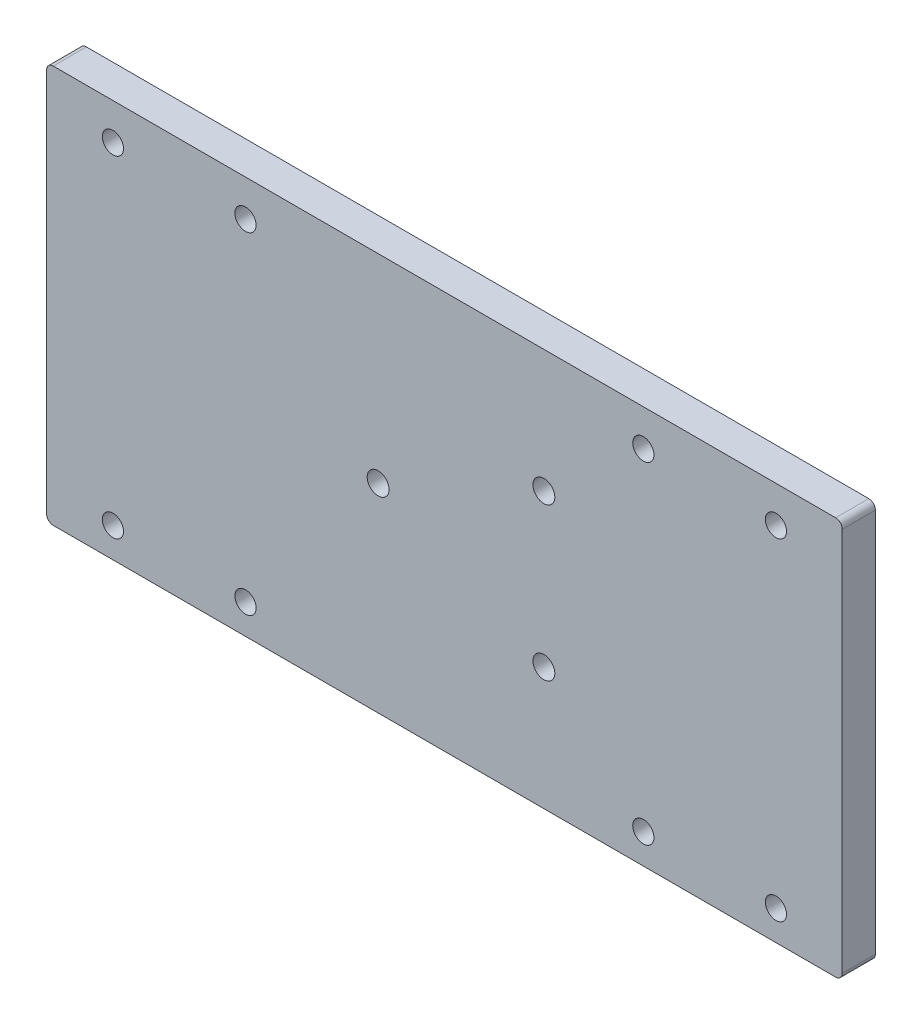
from build123d import *

# Parameters (mm, degrees)
SKETCH_1_W          = 120
SKETCH_1_H          = 60
EXTRUDE_1_DEPTH     = 5
CUT_EXTRUDE_1_REACH = 115.997
SKETCH_2_R          = 1.65
CUT_EXTRUDE_2_REACH = 115.997
SKETCH_4_R          = 1.6
FILLET_1_R          = 1


with BuildPart() as part:
    # 草图1 → 凸台-拉伸1 (new body)
    with BuildSketch(Plane.XY):
        with Locations((-40, -24.5)):
            Rectangle(SKETCH_1_W, SKETCH_1_H)
    extrude(amount=EXTRUDE_1_DEPTH)

    # 草图2 → 切除-拉伸1 (cut, up to next)
    with BuildSketch(Plane.XY.offset(5), mode=Mode.PRIVATE) as cut_extrude_1_sk1:
        with Locations((-25, -13)):
            Circle(SKETCH_2_R)
    cut_extrude_1_tool1 = extrude(cut_extrude_1_sk1.sketch, amount=-CUT_EXTRUDE_1_REACH, mode=Mode.PRIVATE) & part.part
    # 草图2 → 切除-拉伸1 (cut, up to next)
    with BuildSketch(Plane.XY.offset(5), mode=Mode.PRIVATE) as cut_extrude_1_sk2:
        with Locations((-50, -24.5)):
            Circle(SKETCH_2_R)
    cut_extrude_1_tool2 = extrude(cut_extrude_1_sk2.sketch, amount=-CUT_EXTRUDE_1_REACH, mode=Mode.PRIVATE) & part.part
    # 草图2 → 切除-拉伸1 (cut, up to next)
    with BuildSketch(Plane.XY.offset(5), mode=Mode.PRIVATE) as cut_extrude_1_sk3:
        with Locations((-25, -36)):
            Circle(SKETCH_2_R)
    cut_extrude_1_tool3 = extrude(cut_extrude_1_sk3.sketch, amount=-CUT_EXTRUDE_1_REACH, mode=Mode.PRIVATE) & part.part
    add(cut_extrude_1_tool1.solids().sort_by_distance((-25, -13, 5))[0], mode=Mode.SUBTRACT)
    add(cut_extrude_1_tool2.solids().sort_by_distance((-50, -24.5, 5))[0], mode=Mode.SUBTRACT)
    add(cut_extrude_1_tool3.solids().sort_by_distance((-25, -36, 5))[0], mode=Mode.SUBTRACT)

    # 草图4 → 切除-拉伸2 (cut, up to next)
    with BuildSketch(Plane(origin=(0, 0, 0), x_dir=(-1, 0, 0), z_dir=(0, 0, -1)), mode=Mode.PRIVATE) as cut_extrude_2_sk1:
        with Locations((90, 0)):
            Circle(SKETCH_4_R)
    cut_extrude_2_tool1 = extrude(cut_extrude_2_sk1.sketch, amount=-CUT_EXTRUDE_2_REACH, mode=Mode.PRIVATE) & part.part
    # 草图4 → 切除-拉伸2 (cut, up to next)
    with BuildSketch(Plane(origin=(0, 0, 0), x_dir=(-1, 0, 0), z_dir=(0, 0, -1)), mode=Mode.PRIVATE) as cut_extrude_2_sk2:
        with Locations((70, 0)):
            Circle(SKETCH_4_R)
    cut_extrude_2_tool2 = extrude(cut_extrude_2_sk2.sketch, amount=-CUT_EXTRUDE_2_REACH, mode=Mode.PRIVATE) & part.part
    # 草图4 → 切除-拉伸2 (cut, up to next)
    with BuildSketch(Plane(origin=(0, 0, 0), x_dir=(-1, 0, 0), z_dir=(0, 0, -1)), mode=Mode.PRIVATE) as cut_extrude_2_sk3:
        with Locations((70, -50)):
            Circle(SKETCH_4_R)
    cut_extrude_2_tool3 = extrude(cut_extrude_2_sk3.sketch, amount=-CUT_EXTRUDE_2_REACH, mode=Mode.PRIVATE) & part.part
    # 草图4 → 切除-拉伸2 (cut, up to next)
    with BuildSketch(Plane(origin=(0, 0, 0), x_dir=(-1, 0, 0), z_dir=(0, 0, -1)), mode=Mode.PRIVATE) as cut_extrude_2_sk4:
        with Locations((90, -50)):
            Circle(SKETCH_4_R)
    cut_extrude_2_tool4 = extrude(cut_extrude_2_sk4.sketch, amount=-CUT_EXTRUDE_2_REACH, mode=Mode.PRIVATE) & part.part
    # 草图4 → 切除-拉伸2 (cut, up to next)
    with BuildSketch(Plane(origin=(0, 0, 0), x_dir=(-1, 0, 0), z_dir=(0, 0, -1)), mode=Mode.PRIVATE) as cut_extrude_2_sk5:
        with Locations((10, -50)):
            Circle(SKETCH_4_R)
    cut_extrude_2_tool5 = extrude(cut_extrude_2_sk5.sketch, amount=-CUT_EXTRUDE_2_REACH, mode=Mode.PRIVATE) & part.part
    # 草图4 → 切除-拉伸2 (cut, up to next)
    with BuildSketch(Plane(origin=(0, 0, 0), x_dir=(-1, 0, 0), z_dir=(0, 0, -1)), mode=Mode.PRIVATE) as cut_extrude_2_sk6:
        with Locations((-10, -50)):
            Circle(SKETCH_4_R)
    cut_extrude_2_tool6 = extrude(cut_extrude_2_sk6.sketch, amount=-CUT_EXTRUDE_2_REACH, mode=Mode.PRIVATE) & part.part
    # 草图4 → 切除-拉伸2 (cut, up to next)
    with BuildSketch(Plane(origin=(0, 0, 0), x_dir=(-1, 0, 0), z_dir=(0, 0, -1)), mode=Mode.PRIVATE) as cut_extrude_2_sk7:
        with Locations((-10, 0)):
            Circle(SKETCH_4_R)
    cut_extrude_2_tool7 = extrude(cut_extrude_2_sk7.sketch, amount=-CUT_EXTRUDE_2_REACH, mode=Mode.PRIVATE) & part.part
    # 草图4 → 切除-拉伸2 (cut, up to next)
    with BuildSketch(Plane(origin=(0, 0, 0), x_dir=(-1, 0, 0), z_dir=(0, 0, -1)), mode=Mode.PRIVATE) as cut_extrude_2_sk8:
        with Locations((10, 0)):
            Circle(SKETCH_4_R)
    cut_extrude_2_tool8 = extrude(cut_extrude_2_sk8.sketch, amount=-CUT_EXTRUDE_2_REACH, mode=Mode.PRIVATE) & part.part
    add(cut_extrude_2_tool1.solids().sort_by_distance((-90, 0, 0))[0], mode=Mode.SUBTRACT)
    add(cut_extrude_2_tool2.solids().sort_by_distance((-70, 0, 0))[0], mode=Mode.SUBTRACT)
    add(cut_extrude_2_tool3.solids().sort_by_distance((-70, -50, 0))[0], mode=Mode.SUBTRACT)
    add(cut_extrude_2_tool4.solids().sort_by_distance((-90, -50, 0))[0], mode=Mode.SUBTRACT)
    add(cut_extrude_2_tool5.solids().sort_by_distance((-10, -50, 0))[0], mode=Mode.SUBTRACT)
    add(cut_extrude_2_tool6.solids().sort_by_distance((10, -50, 0))[0], mode=Mode.SUBTRACT)
    add(cut_extrude_2_tool7.solids().sort_by_distance((10, 0, 0))[0], mode=Mode.SUBTRACT)
    add(cut_extrude_2_tool8.solids().sort_by_distance((-10, 0, 0))[0], mode=Mode.SUBTRACT)

    # 圆角1
    fillet_1_edges = [part.edges().sort_by_distance(p)[0] for p in [
        (20, -54.5, 2.5),
        (-100, -54.5, 2.5),
        (-100, 5.5, 2.5),
        (20, 5.5, 2.5),
    ]]
    fillet(fillet_1_edges, radius=FILLET_1_R)


solid = part.part
